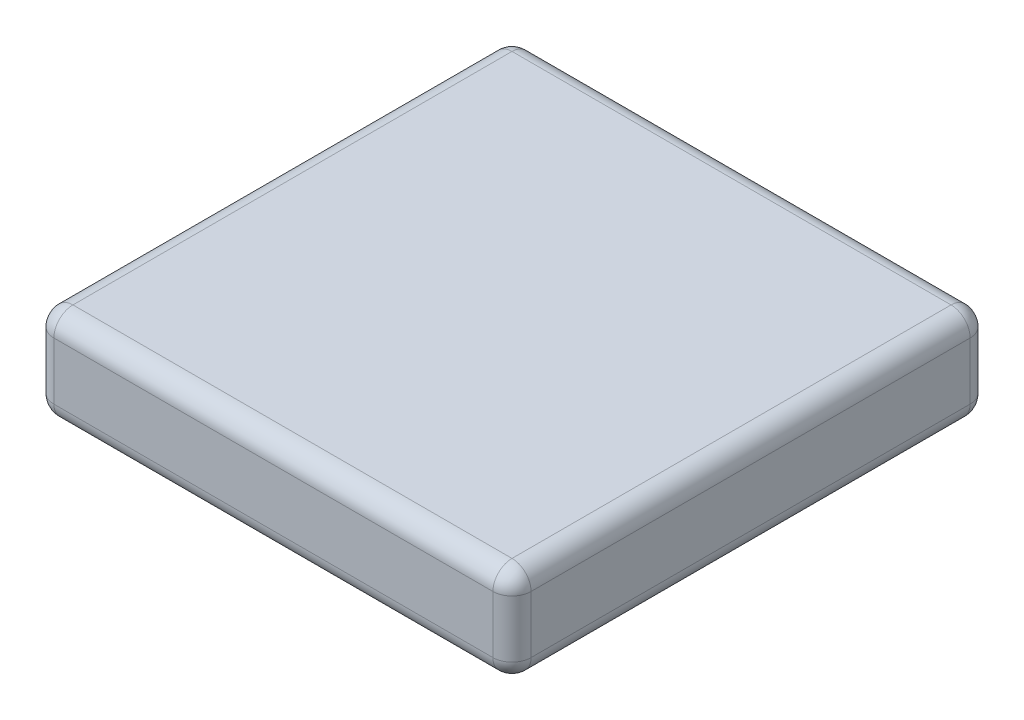
from build123d import *

# Parameters (mm, degrees)
SKETCH1_W           = 50
SKETCH1_H           = 50
BOSS_EXTRUDE1_DEPTH = 10
FILLET1_R           = 2
FILLET2_R           = 2
FILLET3_R           = 2
FILLET4_R           = 2
FILLET5_R           = 2


with BuildPart() as part:
    # Sketch1 → Boss-Extrude1 (new body)
    with BuildSketch(Plane(origin=(0, 0, 0), x_dir=(1, 0, 0), z_dir=(0, 1, 0))):
        Rectangle(SKETCH1_W, SKETCH1_H)
    extrude(amount=BOSS_EXTRUDE1_DEPTH)

    # Fillet1
    fillet1_edges = [part.edges().sort_by_distance(p)[0] for p in [
        (0, 10, 25),
    ]]
    fillet(fillet1_edges, radius=FILLET1_R)

    # Fillet2
    fillet2_edges = [part.edges().sort_by_distance(p)[0] for p in [
        (25, 10, -1),
        (25, 4, 25),
        (25, 9.414213562, 24.414213562),
    ]]
    fillet(fillet2_edges, radius=FILLET2_R)

    # Fillet3
    fillet3_edges = [part.edges().sort_by_distance(p)[0] for p in [
        (25, 4, -25),
        (-1, 10, -25),
        (24.414213562, 9.414213562, -25),
    ]]
    fillet(fillet3_edges, radius=FILLET3_R)

    # Fillet4
    fillet4_edges = [part.edges().sort_by_distance(p)[0] for p in [
        (-25, 4, 25),
        (-25, 9.414213562, 24.414213562),
        (-25, 4, -25),
        (-25, 10, 0),
        (-25, 9.414213562, -24.414213562),
    ]]
    fillet(fillet4_edges, radius=FILLET4_R)

    # Fillet5
    fillet5_edges = [part.edges().sort_by_distance(p)[0] for p in [
        (25, 0, 0),
        (24.414213562, 0, 24.414213562),
        (0, 0, -25),
        (24.414213562, 0, -24.414213562),
        (-25, 0, 0),
        (0, 0, 25),
        (-24.414213562, 0, 24.414213562),
        (-24.414213562, 0, -24.414213562),
    ]]
    fillet(fillet5_edges, radius=FILLET5_R)


solid = part.part
